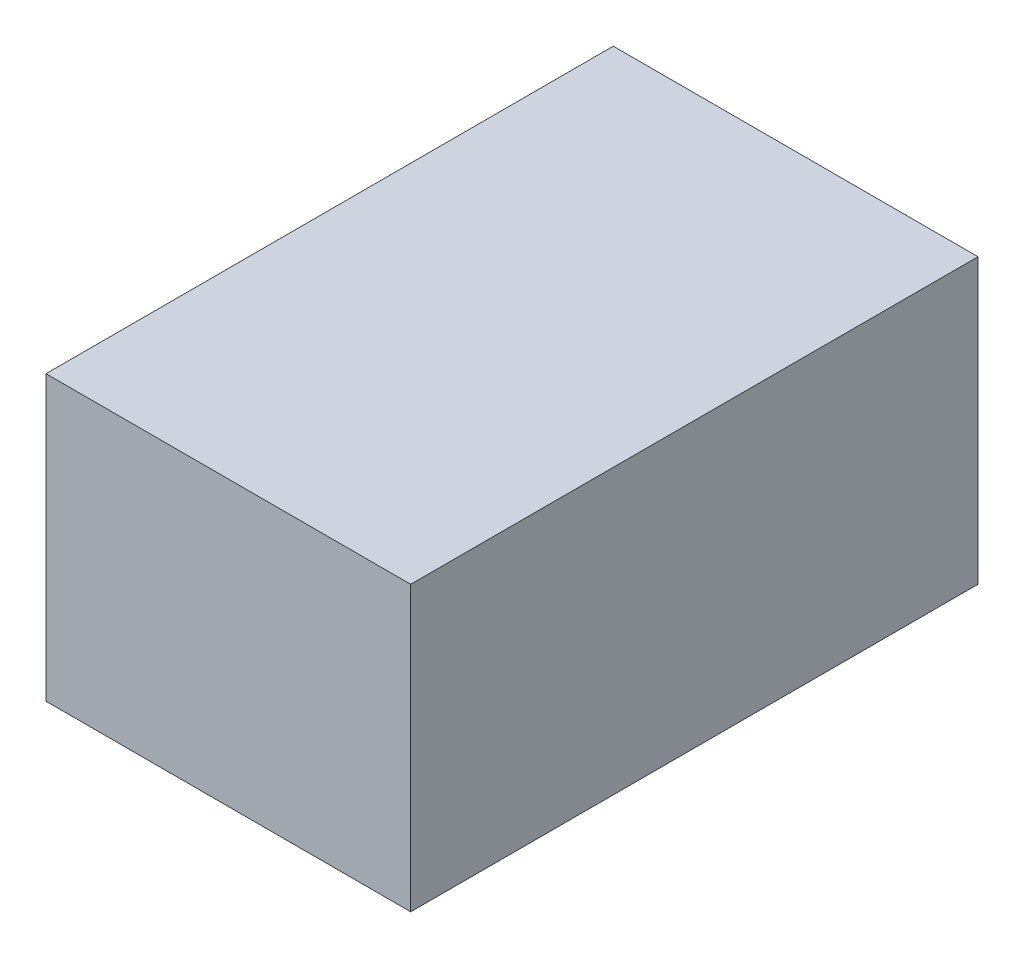
from build123d import *

# Parameters (mm, degrees)
SKETCH1_W           = 90
SKETCH1_H           = 140
BOSS_EXTRUDE1_DEPTH = 70


with BuildPart() as part:
    # Sketch1 → Boss-Extrude1 (new body)
    with BuildSketch(Plane(origin=(0, 0, 0), x_dir=(1, 0, 0), z_dir=(0, 1, 0))):
        Rectangle(SKETCH1_W, SKETCH1_H)
    extrude(amount=BOSS_EXTRUDE1_DEPTH)


solid = part.part
